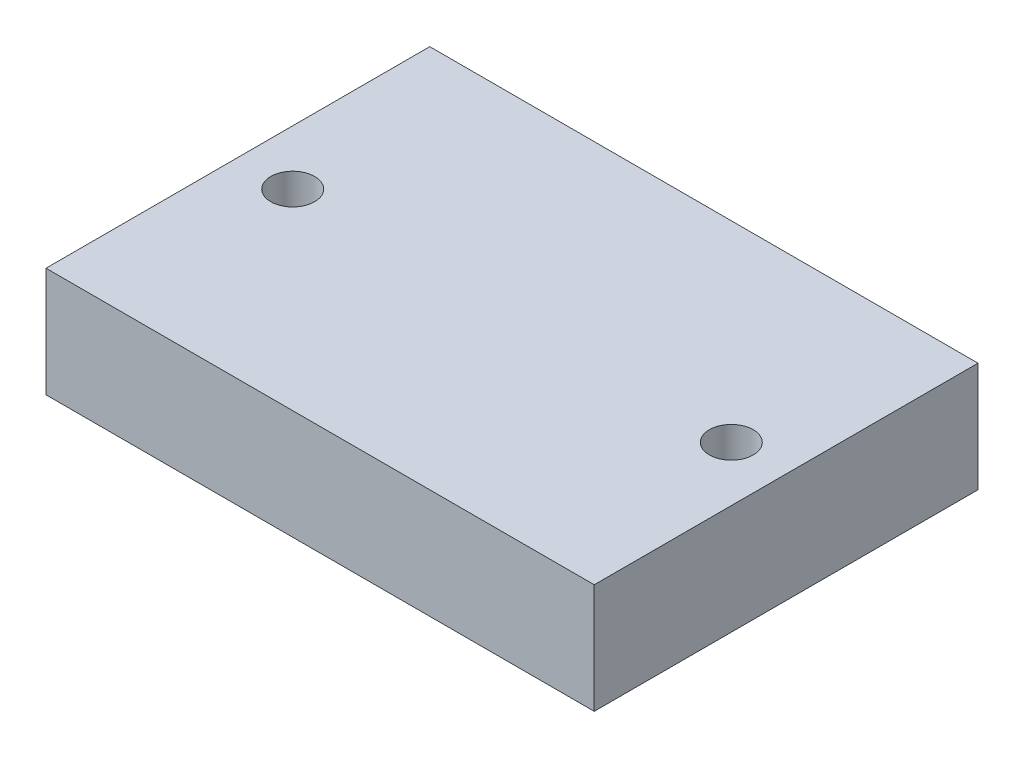
from build123d import *

# Parameters (mm, degrees)
SKETCH1_W             = 50
SKETCH1_H             = 35
BOSS_EXTRUDE1_DEPTH   = 10
F_4_0MM_DOWEL_HOLE1_D = 4


with BuildPart() as part:
    # Sketch1 → Boss-Extrude1 (new body)
    with BuildSketch(Plane(origin=(0, 0, 0), x_dir=(1, 0, 0), z_dir=(0, 1, 0))):
        Rectangle(SKETCH1_W, SKETCH1_H)
    extrude(amount=BOSS_EXTRUDE1_DEPTH)

    # Ø4.0mm Dowel Hole1 (through all)
    with Locations(Plane(origin=(0, 10, 0), x_dir=(1, 0, 0), z_dir=(0, 1, 0))):
        with Locations((-20, 0), (20, 0)):
            Hole(F_4_0MM_DOWEL_HOLE1_D / 2)


solid = part.part
